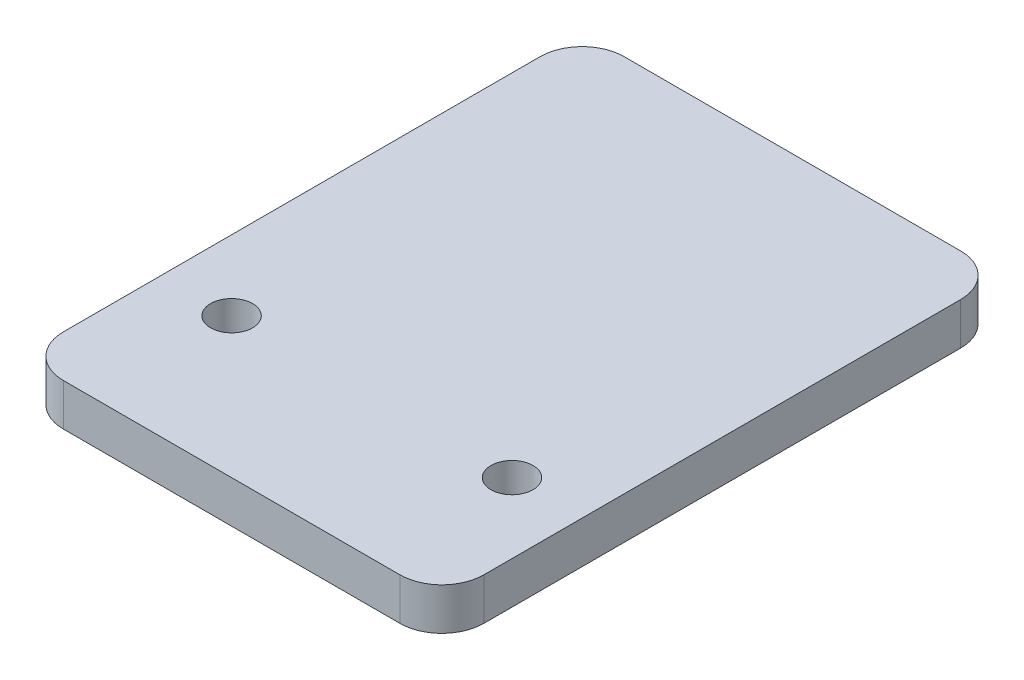
from build123d import *

# Parameters (mm, degrees)
SKETCH_1_W          = 30
SKETCH_1_H          = 40
EXTRUDE_1_DEPTH     = 3
SKETCH_2_R          = 1.5
CUT_EXTRUDE_1_DEPTH = 26.179356624
FILLET_1_R          = 3


with BuildPart() as part:
    # 草图1 → 凸台-拉伸1 (new body)
    with BuildSketch(Plane(origin=(0, 0, 0), x_dir=(1, 0, 0), z_dir=(0, 1, 0))):
        Rectangle(SKETCH_1_W, SKETCH_1_H)
    extrude(amount=EXTRUDE_1_DEPTH)

    # 草图2 → 切除-拉伸1 (cut, through all)
    with BuildSketch(Plane(origin=(0, 3, 0), x_dir=(1, 0, 0), z_dir=(0, 1, 0))):
        with Locations(Location((-10, -10, 0), (0, 0, 270))):
            Circle(SKETCH_2_R)
        with Locations(Location((10, -10, 0), (0, 0, 90))):
            Circle(SKETCH_2_R)
    extrude(amount=-CUT_EXTRUDE_1_DEPTH, mode=Mode.SUBTRACT)

    # 圆角1
    fillet_1_edges = [part.edges().sort_by_distance(p)[0] for p in [
        (15, 1.5, 20),
        (-15, 1.5, 20),
        (-15, 1.5, -20),
        (15, 1.5, -20),
    ]]
    fillet(fillet_1_edges, radius=FILLET_1_R)


solid = part.part
